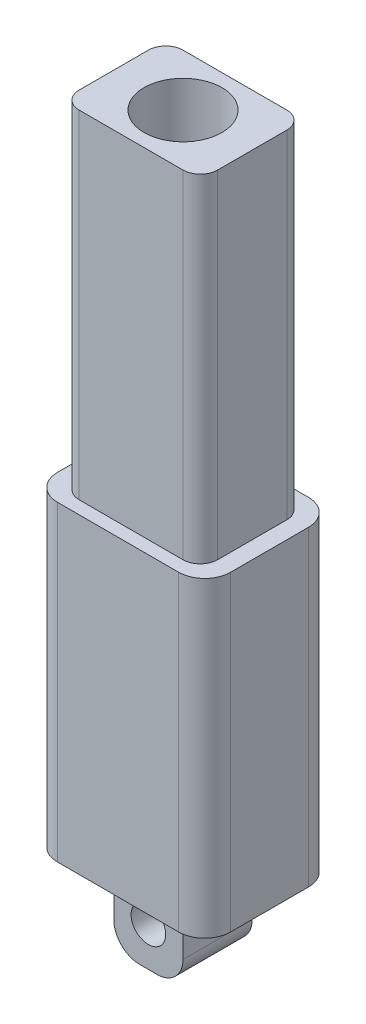
from build123d import *

# Parameters (mm, degrees)
SKETCH_1_W          = 20
SKETCH_1_H          = 15
EXTRUDE_1_DEPTH     = 36
SKETCH_2_W          = 8
SKETCH_2_H          = 9
SKETCH_2_R          = 2
EXTRUDE_2_DEPTH     = 4
FILLET_1_R          = 3
SKETCH_3_W          = 16
SKETCH_3_H          = 39
EXTRUDE_3_DEPTH     = 6
SKETCH_4_R          = 4.5
CUT_EXTRUDE_1_DEPTH = 40
FILLET_2_R          = 3
FILLET_3_R          = 2


with BuildPart() as part:
    # 草图1 → 凸台-拉伸1 (new body)
    with BuildSketch(Plane(origin=(0, 0, 0), x_dir=(1, 0, 0), z_dir=(0, 1, 0))):
        Rectangle(SKETCH_1_W, SKETCH_1_H)
    extrude(amount=EXTRUDE_1_DEPTH)

    # 草图2 → 凸台-拉伸2 (add, symmetric)
    with BuildSketch(Plane.XY):
        with Locations((0, -4.5)):
            Rectangle(SKETCH_2_W, SKETCH_2_H)
        with Locations((0, -4.5)):
            Circle(SKETCH_2_R, mode=Mode.SUBTRACT)
    extrude(amount=EXTRUDE_2_DEPTH, both=True)

    # 圆角1
    fillet_1_edges = [part.edges().sort_by_distance(p)[0] for p in [
        (4, 0, 0),
        (-4, 0, 0),
        (-4, -9, 0),
        (4, -9, 0),
    ]]
    fillet(fillet_1_edges, radius=FILLET_1_R)


with BuildPart() as body_2:
    # 草图3 → 凸台-拉伸3 (new, symmetric)
    with BuildSketch(Plane.XY):
        with Locations((0, 55.5)):
            Rectangle(SKETCH_3_W, SKETCH_3_H)
    extrude(amount=EXTRUDE_3_DEPTH, both=True)


with BuildPart() as cut_extrude_1_tool:
    # 草图4 → 切除-拉伸1 (new body)
    with BuildSketch(Plane(origin=(0, 75, 0), x_dir=(1, 0, 0), z_dir=(0, 1, 0))):
        with Locations(Location((0, 0, 0), (0, 0, 270))):
            Circle(SKETCH_4_R)
    extrude(amount=-CUT_EXTRUDE_1_DEPTH)


with BuildPart() as part_1:
    add(part.part)

    # 切除-拉伸1: cut by cut_extrude_1_tool
    add(cut_extrude_1_tool.part, mode=Mode.SUBTRACT)

    # 圆角2
    fillet_2_edges = [part_1.edges().sort_by_distance(p)[0] for p in [
        (10, 18, 7.5),
        (-10, 18, 7.5),
        (-10, 18, -7.5),
        (10, 18, -7.5),
    ]]
    fillet(fillet_2_edges, radius=FILLET_2_R)


with BuildPart() as body_2_1:
    add(body_2.part)

    # 切除-拉伸1: cut by cut_extrude_1_tool
    add(cut_extrude_1_tool.part, mode=Mode.SUBTRACT)

    # 圆角3
    fillet_3_edges = [body_2_1.edges().sort_by_distance(p)[0] for p in [
        (-8, 55.5, 6),
        (8, 55.5, 6),
        (-8, 55.5, -6),
        (8, 55.5, -6),
    ]]
    fillet(fillet_3_edges, radius=FILLET_3_R)


solid = Compound([part_1.part, body_2_1.part])
